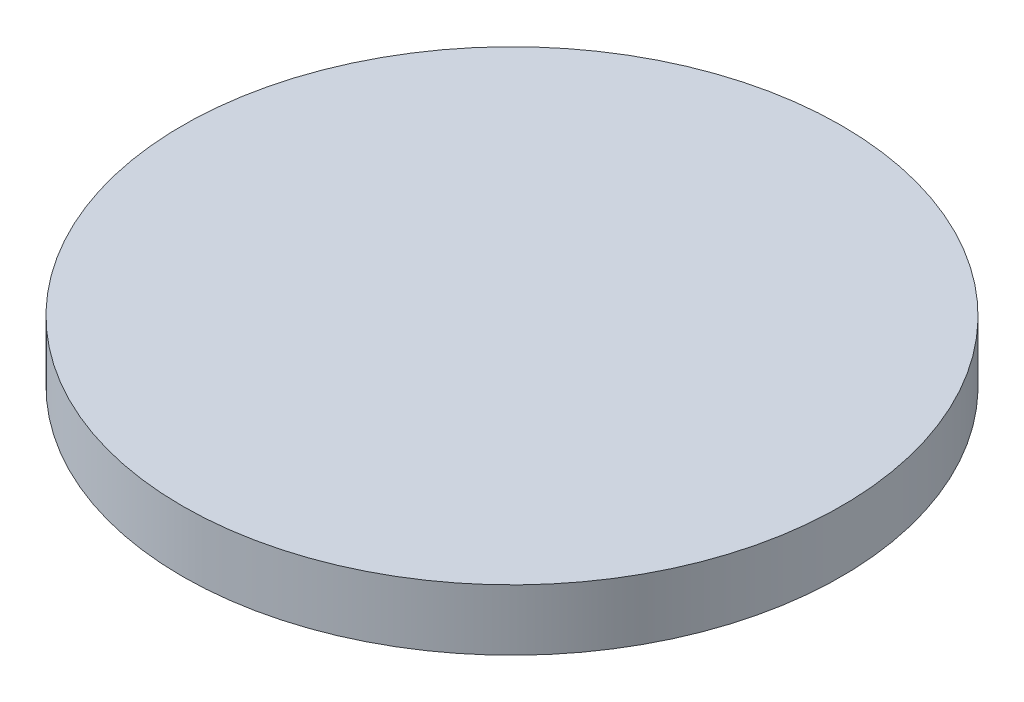
from build123d import *

# Parameters (mm, degrees)
SKETCH1_R           = 40
BOSS_EXTRUDE1_DEPTH = 7.4


with BuildPart() as part:
    # Sketch1 → Boss-Extrude1 (new body)
    with BuildSketch(Plane(origin=(0, 0, 0), x_dir=(1, 0, 0), z_dir=(0, 1, 0))):
        with Locations(Location((0, 0, 0), (0, 0, 270))):
            Circle(SKETCH1_R)
    extrude(amount=BOSS_EXTRUDE1_DEPTH)


solid = part.part
